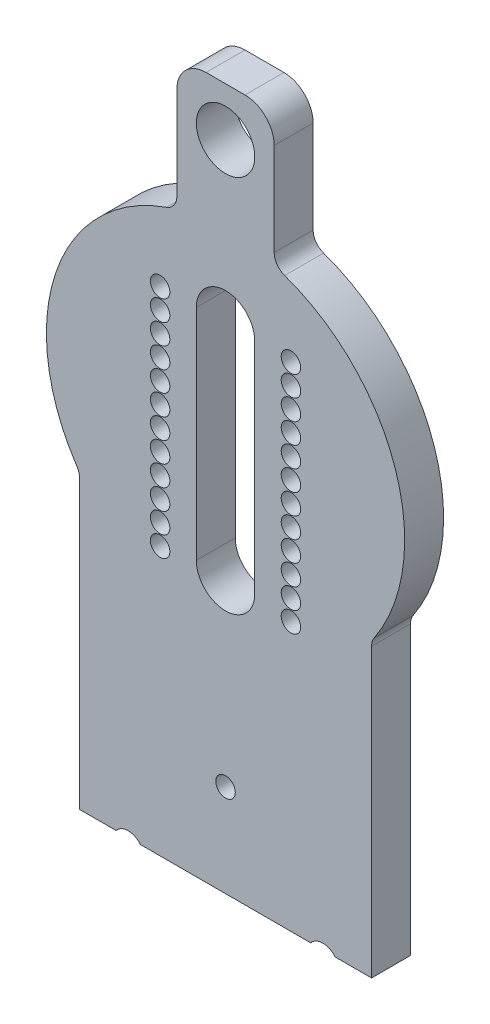
from build123d import *

# Parameters (mm, degrees)
CROQUIS1_R              = 1
SALIENTE_EXTRUIR1_DEPTH = 4
CROQUIS3_R              = 1.25
CORTAR_EXTRUIR1_DEPTH   = 4
SALIENTE_EXTRUIR2_START = -4
CROQUIS4_R              = 3
SALIENTE_EXTRUIR2_DEPTH = 4
REDONDEO1_R             = 3
REDONDEO2_R             = 1.6
CROQUIS5_R              = 1.6
CORTAR_EXTRUIR2_DEPTH   = 4
CROQUIS6_R              = 1
CORTAR_EXTRUIR3_DEPTH   = 4


with BuildPart() as part:
    # Croquis1 → Saliente-Extruir1 (new body)
    with BuildSketch(Plane.XY):
        with BuildLine():
            Line((-15, -10.656453444), (-15, -40.656453444))
            Line((-15, -40.656453444), (15, -40.656453444))
            Line((15, -40.656453444), (15, -10.656453444))
            ThreePointArc((15, -10.656453444), (0, 18.4), (-15, -10.656453444))
        make_face()
        with Locations((-6.72, 10)):
            Circle(CROQUIS1_R, mode=Mode.SUBTRACT)
        with Locations((6.72, 10)):
            Circle(CROQUIS1_R, mode=Mode.SUBTRACT)
        with Locations((-6.72, 7.9)):
            Circle(CROQUIS1_R, mode=Mode.SUBTRACT)
        with Locations((6.72, 7.9)):
            Circle(CROQUIS1_R, mode=Mode.SUBTRACT)
        with Locations((-6.72, 5.8)):
            Circle(CROQUIS1_R, mode=Mode.SUBTRACT)
        with Locations((6.72, 5.8)):
            Circle(CROQUIS1_R, mode=Mode.SUBTRACT)
        with Locations((-6.72, 3.7)):
            Circle(CROQUIS1_R, mode=Mode.SUBTRACT)
        with Locations((6.72, 3.7)):
            Circle(CROQUIS1_R, mode=Mode.SUBTRACT)
        with Locations((-6.72, 1.6)):
            Circle(CROQUIS1_R, mode=Mode.SUBTRACT)
        with Locations((6.72, 1.6)):
            Circle(CROQUIS1_R, mode=Mode.SUBTRACT)
        with Locations((-6.72, -0.5)):
            Circle(CROQUIS1_R, mode=Mode.SUBTRACT)
        with Locations((6.72, -0.5)):
            Circle(CROQUIS1_R, mode=Mode.SUBTRACT)
        with Locations((-6.72, -2.6)):
            Circle(CROQUIS1_R, mode=Mode.SUBTRACT)
        with Locations((6.72, -2.6)):
            Circle(CROQUIS1_R, mode=Mode.SUBTRACT)
        with Locations((-6.72, -4.7)):
            Circle(CROQUIS1_R, mode=Mode.SUBTRACT)
        with Locations((6.72, -4.7)):
            Circle(CROQUIS1_R, mode=Mode.SUBTRACT)
        with Locations((-6.72, -6.8)):
            Circle(CROQUIS1_R, mode=Mode.SUBTRACT)
        with Locations((6.72, -6.8)):
            Circle(CROQUIS1_R, mode=Mode.SUBTRACT)
        with Locations((-6.72, -8.9)):
            Circle(CROQUIS1_R, mode=Mode.SUBTRACT)
        with Locations((6.72, -8.9)):
            Circle(CROQUIS1_R, mode=Mode.SUBTRACT)
        with Locations((-6.72, -11)):
            Circle(CROQUIS1_R, mode=Mode.SUBTRACT)
        with Locations((6.72, -11)):
            Circle(CROQUIS1_R, mode=Mode.SUBTRACT)
        with Locations((-6.72, -13.1)):
            Circle(CROQUIS1_R, mode=Mode.SUBTRACT)
        with Locations((6.72, -13.1)):
            Circle(CROQUIS1_R, mode=Mode.SUBTRACT)
        with BuildLine():
            Line((3, 0), (3, 10))
            ThreePointArc((3, 10), (0, 13), (-3, 10))
            Line((-3, 10), (-3, 0))
            Line((-3, 0), (-3, -12.5))
            ThreePointArc((-3, -12.5), (0, -15.5), (3, -12.5))
            Line((3, -12.5), (3, 0))
        make_face(mode=Mode.SUBTRACT)
    extrude(amount=SALIENTE_EXTRUIR1_DEPTH)

    # Croquis3 → Cortar-Extruir1 (cut)
    with BuildSketch(Plane.XZ.offset(40.656453444)):
        with Locations(Location((-10, 2, 0), (0, 0, 270))):
            Circle(CROQUIS3_R)
        with Locations(Location((10, 2, 0), (0, 0, 90))):
            Circle(CROQUIS3_R)
    extrude(amount=-CORTAR_EXTRUIR1_DEPTH, mode=Mode.SUBTRACT)

    # Croquis4 → Saliente-Extruir2 (add)
    with BuildSketch(Plane.XY.offset(4).offset(SALIENTE_EXTRUIR2_START)):
        with BuildLine():
            Line((5, 31.4), (-5, 31.4))
            Line((-5, 31.4), (-5, 17.707625476))
            ThreePointArc((-5, 17.707625476), (0, 18.4), (5, 17.707625476))
            Line((5, 17.707625476), (5, 31.4))
        make_face()
        with Locations((0, 26.4)):
            Circle(CROQUIS4_R, mode=Mode.SUBTRACT)
    extrude(amount=SALIENTE_EXTRUIR2_DEPTH)

    # Redondeo1
    redondeo1_edges = [part.edges().sort_by_distance(p)[0] for p in [
        (-5, 31.4, 2),
        (5, 31.4, 2),
    ]]
    fillet(redondeo1_edges, radius=REDONDEO1_R)

    # Redondeo2
    redondeo2_edges = [part.edges().sort_by_distance(p)[0] for p in [
        (-5, 17.707625476, 2),
        (5, 17.707625476, 2),
        (15, -10.656453444, 2),
        (-15, -10.656453444, 2),
    ]]
    fillet(redondeo2_edges, radius=REDONDEO2_R)

    # Croquis5 → Cortar-Extruir2 (cut)
    with BuildSketch(Plane.XY.offset(4)):
        with Locations((-10, -41.656453444)):
            Circle(CROQUIS5_R)
        with Locations((10, -41.656453444)):
            Circle(CROQUIS5_R)
    extrude(amount=-CORTAR_EXTRUIR2_DEPTH, mode=Mode.SUBTRACT)

    # Croquis6 → Cortar-Extruir3 (cut)
    with BuildSketch(Plane.XY.offset(4)):
        with Locations((0, -31.156453444)):
            Circle(CROQUIS6_R)
    extrude(amount=-CORTAR_EXTRUIR3_DEPTH, mode=Mode.SUBTRACT)


solid = part.part
